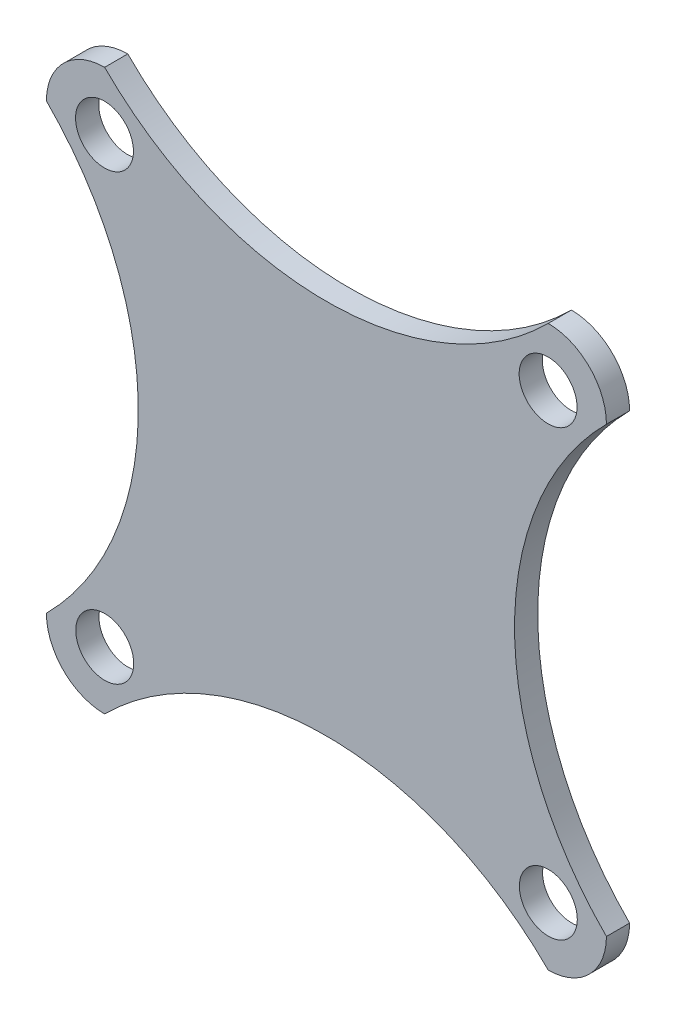
from build123d import *

# Parameters (mm, degrees)
MODEL_R             = 2.25
BOSS_EXTRUDE1_DEPTH = 1.8


with BuildPart() as part:
    # Model → Boss-Extrude1 (new body)
    with BuildSketch(Plane.XY):
        with BuildLine():
            ThreePointArc((-81.255144817, -18.241548457), (-64.020000155, -25.380579125), (-46.784855492, -18.241548457))
            ThreePointArc((-46.784855492, -18.241548457), (-43.586394524, -19.566394369), (-42.261548612, -22.764855338))
            ThreePointArc((-42.261548612, -22.764855338), (-49.40057928, -40), (-42.261548612, -57.235144662))
            ThreePointArc((-42.261548612, -57.235144662), (-43.586394524, -60.433605631), (-46.784855493, -61.758451543))
            ThreePointArc((-46.784855493, -61.758451543), (-64.020000155, -54.619420875), (-81.255144817, -61.758451543))
            ThreePointArc((-81.255144817, -61.758451543), (-84.453605786, -60.433605631), (-85.778451698, -57.235144662))
            ThreePointArc((-85.778451698, -57.235144662), (-78.639421029, -40), (-85.778451698, -22.764855338))
            ThreePointArc((-85.778451698, -22.764855338), (-84.453605786, -19.566394369), (-81.255144817, -18.241548457))
        make_face()
        with Locations((-81.264218317, -22.773928838)):
            Circle(MODEL_R, mode=Mode.SUBTRACT)
        with Locations((-81.246071317, -57.244218163)):
            Circle(MODEL_R, mode=Mode.SUBTRACT)
        with Locations((-46.775781992, -57.226071162)):
            Circle(MODEL_R, mode=Mode.SUBTRACT)
        with Locations((-46.793928993, -22.755781837)):
            Circle(MODEL_R, mode=Mode.SUBTRACT)
    extrude(amount=BOSS_EXTRUDE1_DEPTH)


solid = part.part
